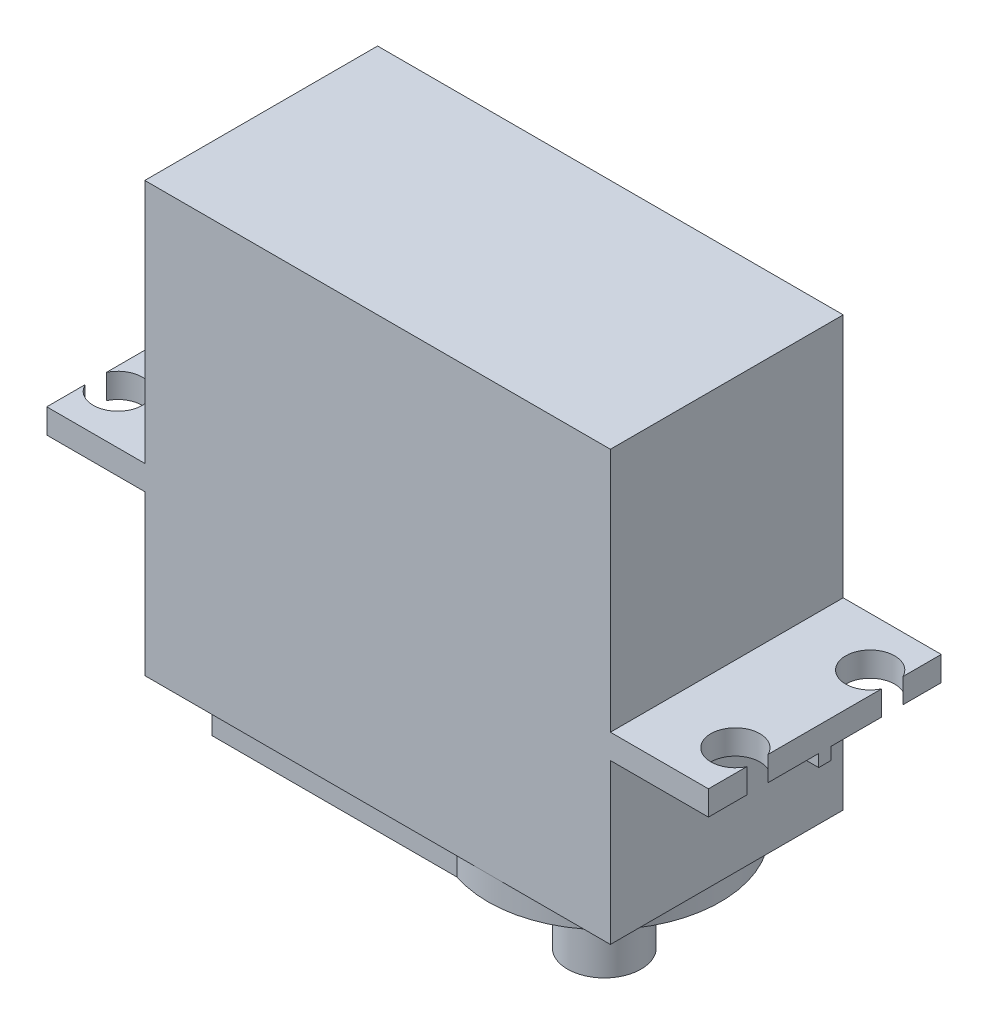
from build123d import *

# Parameters (mm, degrees)
BOSS_EXTRUDE1_DEPTH  = 19
SKETCH6_R            = 2
CUT_EXTRUDE2_DEPTH   = 39.600518131
SKETCH10_W           = 8
SKETCH10_H           = 1
BOSS_EXTRUDE14_DEPTH = 1
BOSS_EXTRUDE15_DEPTH = 2
SKETCH13_R           = 3
CUT_EXTRUDE3_DEPTH   = 5
BOSS_EXTRUDE16_START = 8
SKETCH15_R           = 3
BOSS_EXTRUDE16_DEPTH = 8


with BuildPart() as part:
    # Sketch1 → Boss-Extrude1 (new body)
    with BuildSketch(Plane.XY):
        Polygon((19, 0), (-19, 0), (-19, 13), (-27, 13), (-27, 15), (-19, 15), (-19, 35), (19, 35), (19, 15), (27, 15), (27, 13), (19, 13), align=None)
    extrude(amount=BOSS_EXTRUDE1_DEPTH)

    # Sketch6 → Cut-Extrude2 (cut, through all)
    with BuildSketch(Plane(origin=(0, 15, 0), x_dir=(1, 0, 0), z_dir=(0, 1, 0))):
        with Locations((25.2, -15)):
            Circle(SKETCH6_R)
        with Locations((25.2, -4)):
            Circle(SKETCH6_R)
        with Locations((-25.2, -4)):
            Circle(SKETCH6_R)
        with Locations((-25.2, -15)):
            Circle(SKETCH6_R)
    extrude(amount=-CUT_EXTRUDE2_DEPTH, mode=Mode.SUBTRACT)

    # Sketch10 → Boss-Extrude14 (add)
    with BuildSketch(Plane.XZ.offset(-13)):
        with Locations((-23, 9.5)):
            Rectangle(SKETCH10_W, SKETCH10_H)
        with Locations((23, 9.5)):
            Rectangle(SKETCH10_W, SKETCH10_H)
    extrude(amount=BOSS_EXTRUDE14_DEPTH)

    # Sketch12 → Boss-Extrude15 (add)
    with BuildSketch(Plane.XZ):
        with BuildLine():
            Line((-14, 18.5), (6, 18.5))
            ThreePointArc((6, 18.5), (18.486832981, 9.5), (6, 0.5))
            Line((6, 0.5), (-14, 0.5))
            Line((-14, 0.5), (-14, 18.5))
        make_face()
    extrude(amount=BOSS_EXTRUDE15_DEPTH)

    # Sketch13 → Cut-Extrude3 (cut)
    with BuildSketch(Plane.XZ.offset(2)):
        with Locations(Location((9, 9.5, 0), (0, 0, 270))):
            Circle(SKETCH13_R)
    extrude(amount=-CUT_EXTRUDE3_DEPTH, mode=Mode.SUBTRACT)


with BuildPart() as body_2:
    # Sketch15 → Boss-Extrude16 (new body)
    with BuildSketch(Plane.XZ.offset(2).offset(BOSS_EXTRUDE16_START)):
        with Locations(Location((9, 9.5, 0), (0, 0, 270))):
            Circle(SKETCH15_R)
    extrude(amount=-BOSS_EXTRUDE16_DEPTH)


solid = Compound([part.part, body_2.part])
